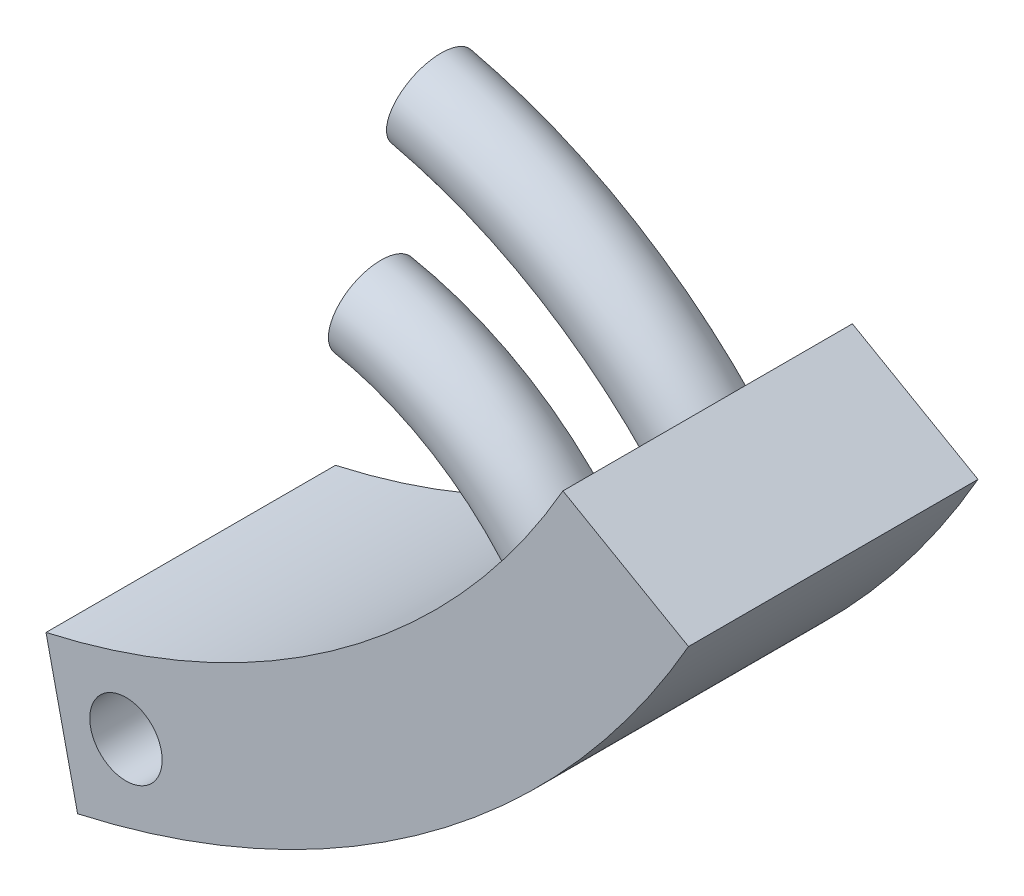
from build123d import *

# Parameters (mm, degrees)
BOSS_EXTRUDE1_DEPTH     = 40
CUT_EXTRUDE1_DEPTH      = 111.69728555
CUT_EXTRUDE1_DEPTH_BACK = 111.69728555
SKETCH3_R               = 5
SWEEP3_PROFILE_R        = 6
SWEEP4_PROFILE_R        = 6


with BuildPart() as part:
    # Sketch1 → Boss-Extrude1 (new body)
    with BuildSketch(Plane.XY):
        with BuildLine():
            Line((0, 0), (4.364992014, -19.517859635))
            ThreePointArc((4.364992014, -19.517859635), (53.125172498, 2.703315983), (88.780401421, 42.703822193))
            Line((88.780401421, 42.703822193), (71.428423344, 52.649115393))
            ThreePointArc((71.428423344, 52.649115393), (41.258614256, 18.802533215), (0, 0))
        make_face()
    extrude(amount=BOSS_EXTRUDE1_DEPTH)

    # Sketch3 → Cut-Extrude1 (cut, two sides: drawn at the far end of the back side and taken through both)
    with BuildSketch(Plane.XY.offset(40).offset(-CUT_EXTRUDE1_DEPTH_BACK)):
        with Locations((11.048099116, -7.247975554)):
            Circle(SKETCH3_R)
    extrude(amount=CUT_EXTRUDE1_DEPTH + CUT_EXTRUDE1_DEPTH_BACK, mode=Mode.SUBTRACT)

    # Sweep3: sweep along a path in Sketch32
    with BuildLine(Plane.XY.offset(15)) as sweep3_path:
        ThreePointArc((65.395294118, 44.437442075), (48.35413652, 57.815528603), (28.200002322, 65.764435832))
    # Sweep3 profile (on start of the path) → Sweep3 (sweep)
    with BuildSketch(Plane(origin=(65.395294118, 44.437442075, 15), x_dir=(0.7246292666888544, 0.6891389017157377, 0), z_dir=(-0.6891389017157377, 0.7246292666888544, 0))):
        Circle(SWEEP3_PROFILE_R)
    sweep(path=sweep3_path.line)

    # Sweep4: sweep along a path in Sketch48
    with BuildLine(Plane.XY.offset(15)) as sweep4_path:
        ThreePointArc((51.136783714, 14.042285968), (38.184106553, 28.895053348), (20.126776716, 36.788682657))
    # Sweep4 profile (on start of the path) → Sweep4 (sweep)
    with BuildSketch(Plane(origin=(51.136783714, 14.042285968, 15), x_dir=(0.879297732143527, 0.47627250418982864, 0), z_dir=(-0.47627250418982864, 0.879297732143527, 0))):
        Circle(SWEEP4_PROFILE_R)
    sweep(path=sweep4_path.line)


solid = part.part
